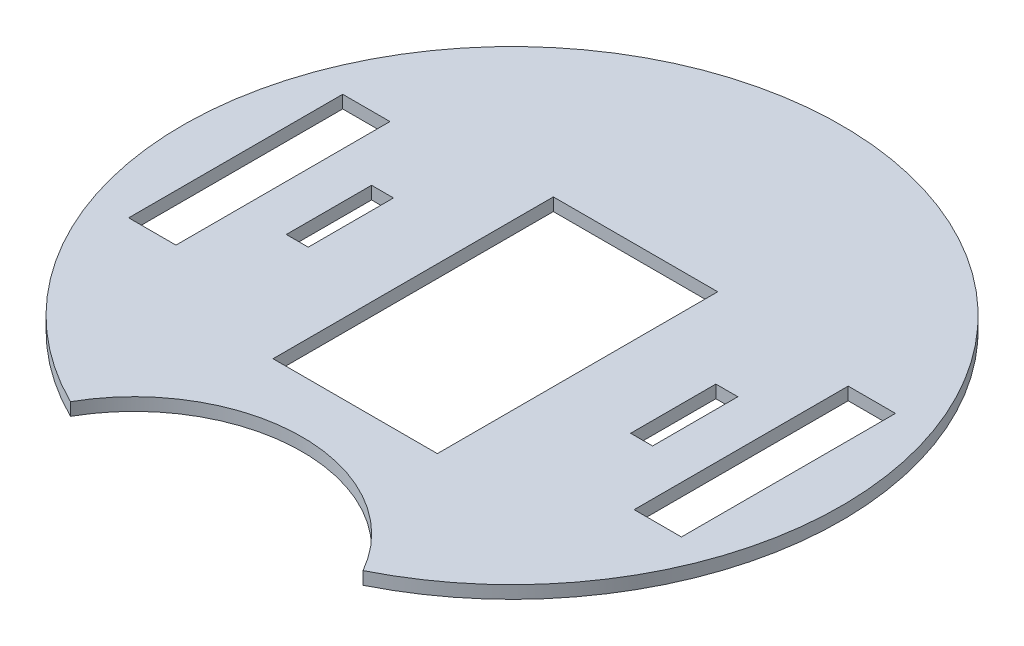
from build123d import *

# Parameters (mm, degrees)
BOSS_EXTRUDE1_DEPTH  = 2.9
SOLENOID_PLACEMENT_W = 37.4
SOLENOID_PLACEMENT_H = 63.8
CUT_EXTRUDE1_DEPTH   = 107.105654892
SKETCH2_W            = 10.76
SKETCH2_H            = 48.705567506
CUT_EXTRUDE2_DEPTH   = 107.105654892
SKETCH3_W            = 5
SKETCH3_H            = 19.4
CUT_EXTRUDE3_DEPTH   = 107.105654892


with BuildPart() as part:
    # Sketch1 → Boss-Extrude1 (new body)
    with BuildSketch(Plane(origin=(0, 0, 0), x_dir=(1, 0, 0), z_dir=(0, 1, 0))):
        with BuildLine():
            ThreePointArc((33.29110537, -67.206415641), (0, 75), (-33.29110537, -67.206415641))
            ThreePointArc((-33.29110537, -67.206415641), (0, -47.791616815), (33.29110537, -67.206415641))
        make_face()
    extrude(amount=BOSS_EXTRUDE1_DEPTH)

    # solenoid placement → Cut-Extrude1 (cut, through all)
    with BuildSketch(Plane(origin=(0, 2.9, 0), x_dir=(1, 0, 0), z_dir=(0, 1, 0))):
        with Locations((0, -3.8)):
            Rectangle(SOLENOID_PLACEMENT_W, SOLENOID_PLACEMENT_H)
    extrude(amount=-CUT_EXTRUDE1_DEPTH, mode=Mode.SUBTRACT)

    # Sketch2 → Cut-Extrude2 (cut, through all)
    with BuildSketch(Plane(origin=(0, 2.9, 0), x_dir=(1, 0, 0), z_dir=(0, 1, 0))):
        with Locations((57.517491988, 0)):
            Rectangle(SKETCH2_W, SKETCH2_H)
        with Locations((-57.517491988, 0)):
            Rectangle(SKETCH2_W, SKETCH2_H)
    extrude(amount=-CUT_EXTRUDE2_DEPTH, mode=Mode.SUBTRACT)

    # Sketch3 → Cut-Extrude3 (cut, through all)
    with BuildSketch(Plane(origin=(0, 2.9, 0), x_dir=(1, 0, 0), z_dir=(0, 1, 0))):
        with Locations((-39.179852803, 0)):
            Rectangle(SKETCH3_W, SKETCH3_H)
        with Locations((39.179852803, 0)):
            Rectangle(SKETCH3_W, SKETCH3_H)
    extrude(amount=-CUT_EXTRUDE3_DEPTH, mode=Mode.SUBTRACT)


solid = part.part
